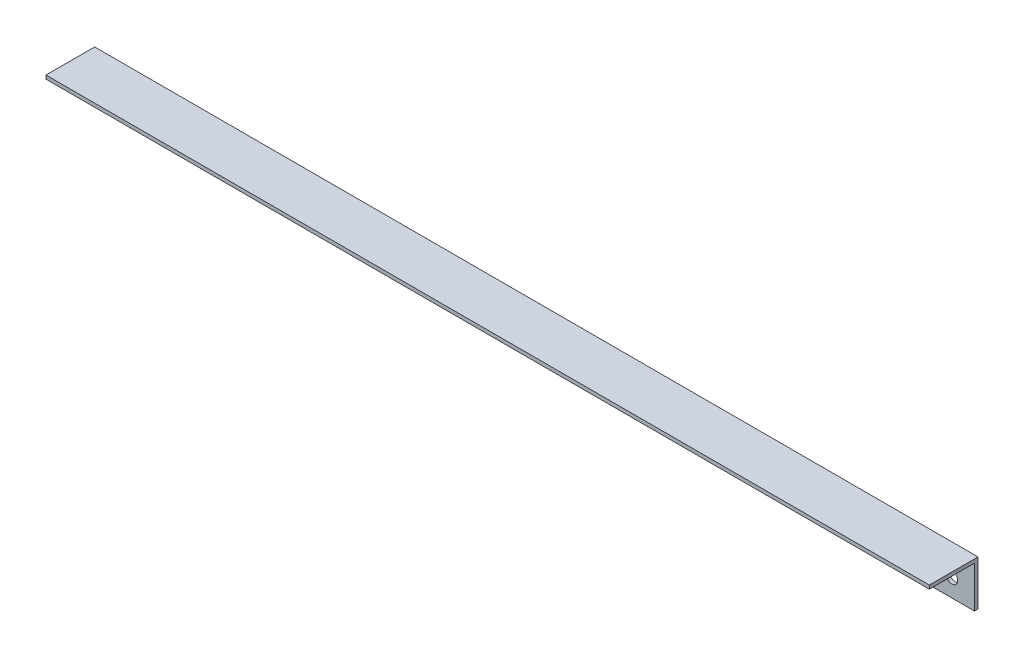
from build123d import *

# Parameters (mm, degrees)
SKETCH_1_W        = 1960
SKETCH_1_H        = 100
SKETCH_1_R        = 13
EXTRUDE_708_DEPTH = 8
SKETCH_2_W        = 1960
SKETCH_2_H        = 8
EXTRUDE_1_DEPTH   = 100


with BuildPart() as part:
    # 草图1 → Extrude 708 (new body)
    with BuildSketch(Plane.XY):
        with Locations((0, 44.512115183)):
            Rectangle(SKETCH_1_W, SKETCH_1_H)
        with Locations((930, 34.512115183)):
            Circle(SKETCH_1_R, mode=Mode.SUBTRACT)
        with Locations((850, 34.512115183)):
            Circle(SKETCH_1_R, mode=Mode.SUBTRACT)
        with Locations((770, 34.512115183)):
            Circle(SKETCH_1_R, mode=Mode.SUBTRACT)
        with Locations((330, 34.512115183)):
            Circle(SKETCH_1_R, mode=Mode.SUBTRACT)
        with Locations((250, 34.512115183)):
            Circle(SKETCH_1_R, mode=Mode.SUBTRACT)
        with Locations(Location((-770, 34.512115183, 0), (0, 0, 180))):
            Circle(SKETCH_1_R, mode=Mode.SUBTRACT)
        with Locations(Location((-850, 34.512115183, 0), (0, 0, 180))):
            Circle(SKETCH_1_R, mode=Mode.SUBTRACT)
        with Locations((170, 34.512115183)):
            Circle(SKETCH_1_R, mode=Mode.SUBTRACT)
        with Locations(Location((-170, 34.512115183, 0), (0, 0, 180))):
            Circle(SKETCH_1_R, mode=Mode.SUBTRACT)
        with Locations(Location((-250, 34.512115183, 0), (0, 0, 180))):
            Circle(SKETCH_1_R, mode=Mode.SUBTRACT)
        with Locations(Location((-330, 34.512115183, 0), (0, 0, 180))):
            Circle(SKETCH_1_R, mode=Mode.SUBTRACT)
        with Locations(Location((-930, 34.512115183, 0), (0, 0, 180))):
            Circle(SKETCH_1_R, mode=Mode.SUBTRACT)
    extrude(amount=EXTRUDE_708_DEPTH)

    # 草图2 → 凸台-拉伸1 (add)
    with BuildSketch(Plane.XY.offset(8)):
        with Locations((0, 90.512115183)):
            Rectangle(SKETCH_2_W, SKETCH_2_H)
    extrude(amount=EXTRUDE_1_DEPTH)


solid = part.part
